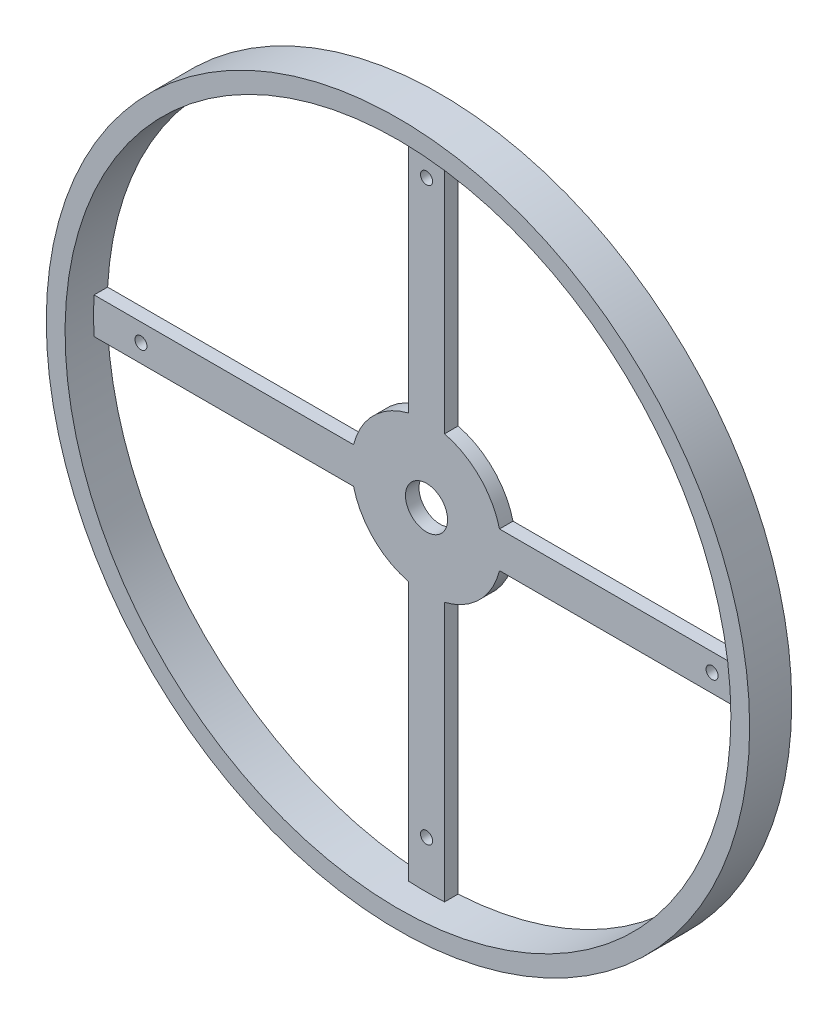
from build123d import *

# Parameters (mm, degrees)
SKETCH1_R           = 11.7
BOSS_EXTRUDE1_DEPTH = 1.4
SKETCH1_3_R         = 0.2
SKETCH1_3_R_2       = 0.7
BOSS_EXTRUDE2_DEPTH = 0.45


with BuildPart() as part:
    # Sketch1 → Boss-Extrude1 (new body)
    with BuildSketch(Plane.XY):
        Circle(SKETCH1_R)
        with BuildLine():
            ThreePointArc((0.6, 11.058735235), (7.831207602, 7.831207602), (11.058735235, 0.6))
            ThreePointArc((11.058735235, 0.6), (11.070933062, 0.300110206), (11.075, 0))
            ThreePointArc((11.075, 0), (11.070933062, -0.300110206), (11.058735235, -0.6))
            ThreePointArc((11.058735235, -0.6), (7.831207602, -7.831207602), (0.6, -11.058735235))
            ThreePointArc((0.6, -11.058735235), (0, -11.075), (-0.6, -11.058735235))
            ThreePointArc((-0.6, -11.058735235), (-7.831207602, -7.831207602), (-11.058735235, -0.6))
            ThreePointArc((-11.058735235, -0.6), (-11.075, 0), (-11.058735235, 0.6))
            ThreePointArc((-11.058735235, 0.6), (-7.831207602, 7.831207602), (-0.6, 11.058735235))
            ThreePointArc((-0.6, 11.058735235), (0, 11.075), (0.6, 11.058735235))
        make_face(mode=Mode.SUBTRACT)
    extrude(amount=BOSS_EXTRUDE1_DEPTH)

    # Sketch1<3> → Boss-Extrude2 (add)
    with BuildSketch(Plane.XY):
        with BuildLine():
            Line((11.058735235, 0.6), (2.42693222, 0.6))
            ThreePointArc((2.42693222, 0.6), (1.767766953, 1.767766953), (0.6, 2.42693222))
            Line((0.6, 2.42693222), (0.6, 11.058735235))
            ThreePointArc((0.6, 11.058735235), (0, 11.075), (-0.6, 11.058735235))
            Line((-0.6, 11.058735235), (-0.6, 2.42693222))
            ThreePointArc((-0.6, 2.42693222), (-1.767766953, 1.767766953), (-2.42693222, 0.6))
            Line((-2.42693222, 0.6), (-11.058735235, 0.6))
            ThreePointArc((-11.058735235, 0.6), (-11.075, 0), (-11.058735235, -0.6))
            Line((-11.058735235, -0.6), (-2.42693222, -0.6))
            ThreePointArc((-2.42693222, -0.6), (-1.767766953, -1.767766953), (-0.6, -2.42693222))
            Line((-0.6, -2.42693222), (-0.6, -11.058735235))
            ThreePointArc((-0.6, -11.058735235), (0, -11.075), (0.6, -11.058735235))
            Line((0.6, -11.058735235), (0.6, -2.42693222))
            ThreePointArc((0.6, -2.42693222), (1.767766953, -1.767766953), (2.42693222, -0.6))
            Line((2.42693222, -0.6), (11.058735235, -0.6))
            ThreePointArc((11.058735235, -0.6), (11.075, 0), (11.058735235, 0.6))
        make_face()
        with Locations((9.5, 0)):
            Circle(SKETCH1_3_R, mode=Mode.SUBTRACT)
        Circle(SKETCH1_3_R_2, mode=Mode.SUBTRACT)
        with Locations((0, -9.5)):
            Circle(SKETCH1_3_R, mode=Mode.SUBTRACT)
        with Locations((-9.5, 0)):
            Circle(SKETCH1_3_R, mode=Mode.SUBTRACT)
        with Locations((0, 9.5)):
            Circle(SKETCH1_3_R, mode=Mode.SUBTRACT)
    extrude(amount=BOSS_EXTRUDE2_DEPTH)


solid = part.part
